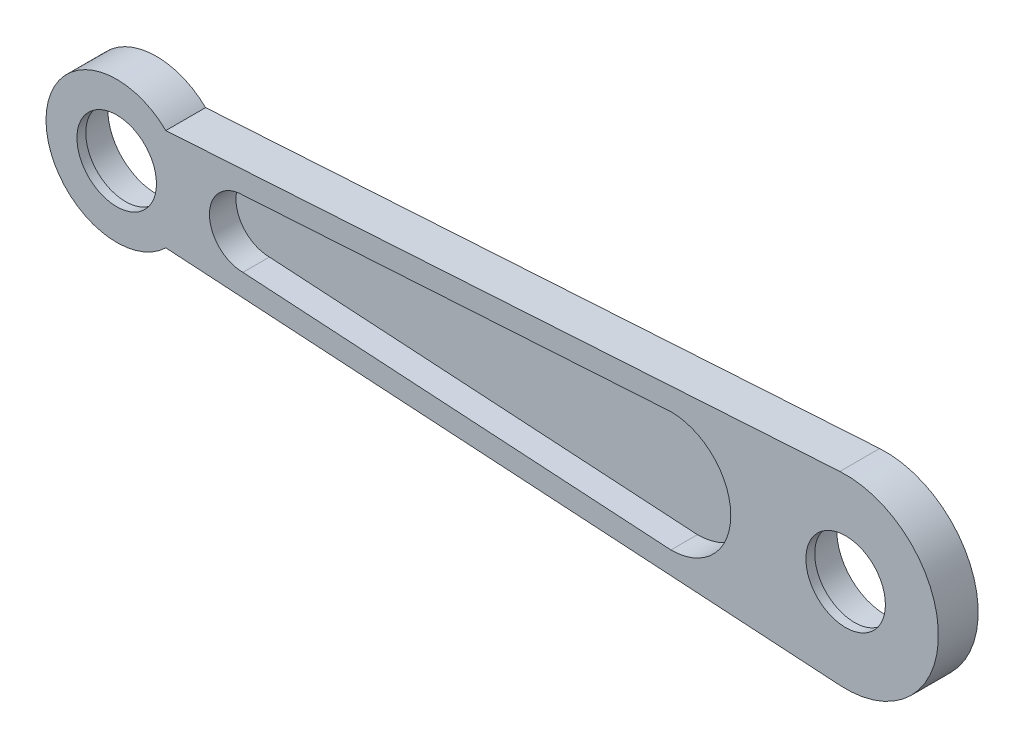
from build123d import *

# Parameters (mm, degrees)
BOSS_EXTRUDE1_DEPTH = 9
SKETCH6_15_R        = 9
CUT_EXTRUDE1_DEPTH  = 188.397972241
SKETCH6_17_R        = 11
CUT_EXTRUDE2_DEPTH  = 7
CUT_EXTRUDE3_START  = 9
CUT_EXTRUDE3_DEPTH  = 6


with BuildPart() as part:
    # Sketch6 → Boss-Extrude1 (new body)
    with BuildSketch(Plane.XY):
        with BuildLine():
            Line((11.124297731, -11.5), (163.700491182, -20.95975374))
            ThreePointArc((163.700491182, -20.95975374), (186, 0), (163.700491182, 20.95975374))
            Line((163.700491182, 20.95975374), (11.124297731, 11.5))
            ThreePointArc((11.124297731, 11.5), (-16, 0), (11.124297731, -11.5))
        make_face()
    extrude(amount=BOSS_EXTRUDE1_DEPTH)

    # Sketch6<15> → Cut-Extrude1 (cut, through all)
    with BuildSketch(Plane.XY):
        with Locations((165, 0)):
            Circle(SKETCH6_15_R)
        Circle(SKETCH6_15_R)
    extrude(amount=CUT_EXTRUDE1_DEPTH, mode=Mode.SUBTRACT)

    # Sketch6<17> → Cut-Extrude2 (cut)
    with BuildSketch(Plane.XY):
        with Locations((165, 0)):
            Circle(SKETCH6_17_R)
        Circle(SKETCH6_17_R)
    extrude(amount=CUT_EXTRUDE2_DEPTH, mode=Mode.SUBTRACT)

    # Sketch6<18> → Cut-Extrude3 (cut)
    with BuildSketch(Plane.XY.offset(CUT_EXTRUDE3_START)):
        with BuildLine():
            Line((28.572170682, 7.572170682), (125.447559308, 13.552440692))
            ThreePointArc((125.447559308, 13.552440692), (139, 0), (125.447559308, -13.552440692))
            Line((125.447559308, -13.552440692), (28.572170682, -7.572170682))
            ThreePointArc((28.572170682, -7.572170682), (21, 0), (28.572170682, 7.572170682))
        make_face()
    extrude(amount=-CUT_EXTRUDE3_DEPTH, mode=Mode.SUBTRACT)


solid = part.part
